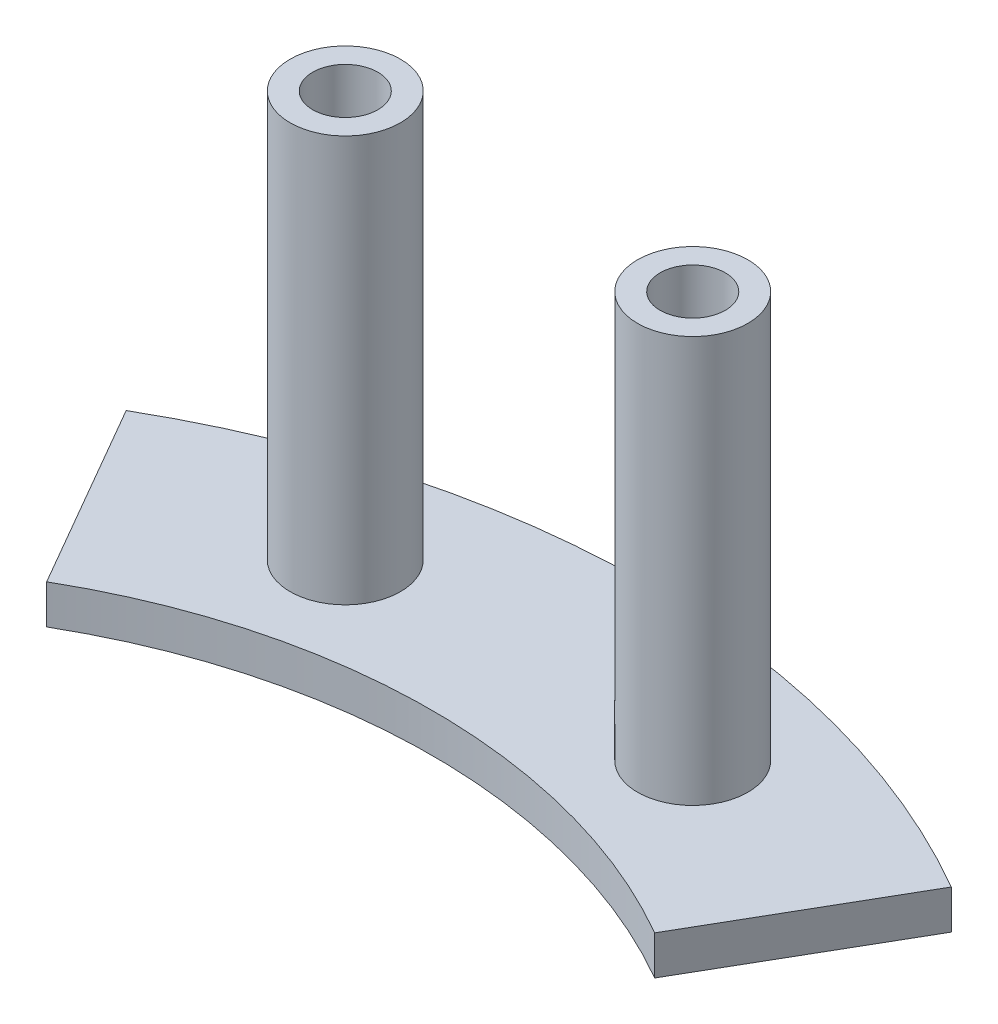
from build123d import *

# Parameters (mm, degrees)
BOSS_EXTRUDE1_DEPTH = 1.8
SKETCH2_R           = 2.54
BOSS_EXTRUDE2_DEPTH = 18.7
SKETCH5_R           = 1.5
CUT_EXTRUDE1_DEPTH  = 3


with BuildPart() as part:
    # Sketch1 → Boss-Extrude1 (new body)
    with BuildSketch(Plane(origin=(0, 0, 0), x_dir=(1, 0, 0), z_dir=(0, 1, 0))):
        with BuildLine():
            Line((-19, 32.908965344), (-14, 24.248711306))
            ThreePointArc((-14, 24.248711306), (0, 28), (14, 24.248711306))
            Line((14, 24.248711306), (19, 32.908965344))
            ThreePointArc((19, 32.908965344), (0, 38), (-19, 32.908965344))
        make_face()
    extrude(amount=BOSS_EXTRUDE1_DEPTH)

    # Sketch2 → Boss-Extrude2 (add)
    with BuildSketch(Plane(origin=(0, 1.8, 0), x_dir=(1, 0, 0), z_dir=(0, 1, 0))):
        with Locations(Location((-8, 32, 0), (0, 0, 90))):
            Circle(SKETCH2_R)
        with Locations(Location((8, 32, 0), (0, 0, 90))):
            Circle(SKETCH2_R)
    extrude(amount=BOSS_EXTRUDE2_DEPTH)

    # Sketch5 → Cut-Extrude1 (cut)
    with BuildSketch(Plane(origin=(0, 20.5, 0), x_dir=(1, 0, 0), z_dir=(0, 1, 0))):
        with Locations(Location((-8, 32, 0), (0, 0, 270))):
            Circle(SKETCH5_R)
        with Locations(Location((8, 32, 0), (0, 0, 270))):
            Circle(SKETCH5_R)
    extrude(amount=-CUT_EXTRUDE1_DEPTH, mode=Mode.SUBTRACT)


solid = part.part
